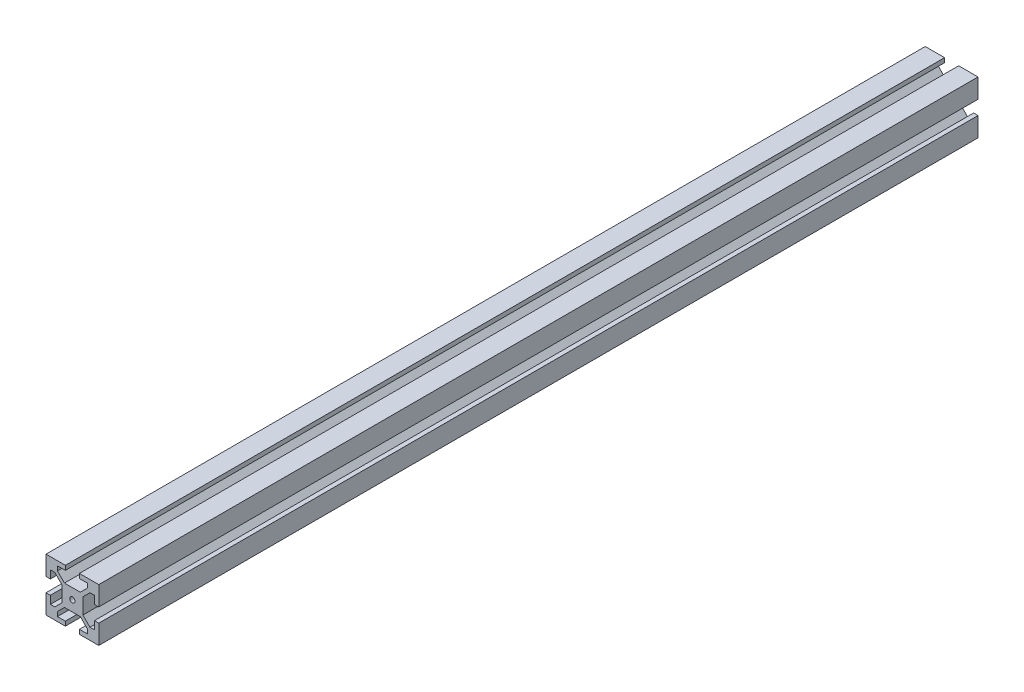
from build123d import *

# Parameters (mm, degrees)
SKETCH1_R           = 1.5
BOSS_EXTRUDE1_DEPTH = 500


with BuildPart() as part:
    # Sketch1 → Boss-Extrude1 (new body)
    with BuildSketch(Plane.XY):
        Polygon((15, 15), (4, 15), (4, 12.5), (8.5, 12.5), (8.5, 10), (4.5, 6), (-4.5, 6), (-8.5, 10), (-8.5, 12.5), (-4, 12.5), (-4, 15), (-15, 15), (-15, 4), (-12.5, 4), (-12.5, 8.5), (-10, 8.5), (-6, 4.5), (-6, -4.5), (-10, -8.5), (-12.5, -8.5), (-12.5, -4), (-15, -4), (-15, -15), (-4, -15), (-4, -12.5), (-8.5, -12.5), (-8.5, -10), (-4.5, -6), (4.5, -6), (8.5, -10), (8.5, -12.5), (4, -12.5), (4, -15), (15, -15), (15, -4), (12.5, -4), (12.5, -8.5), (10, -8.5), (6, -4.5), (6, 4.5), (10, 8.5), (12.5, 8.5), (12.5, 4), (15, 4), align=None)
        Circle(SKETCH1_R, mode=Mode.SUBTRACT)
    extrude(amount=BOSS_EXTRUDE1_DEPTH)


solid = part.part
